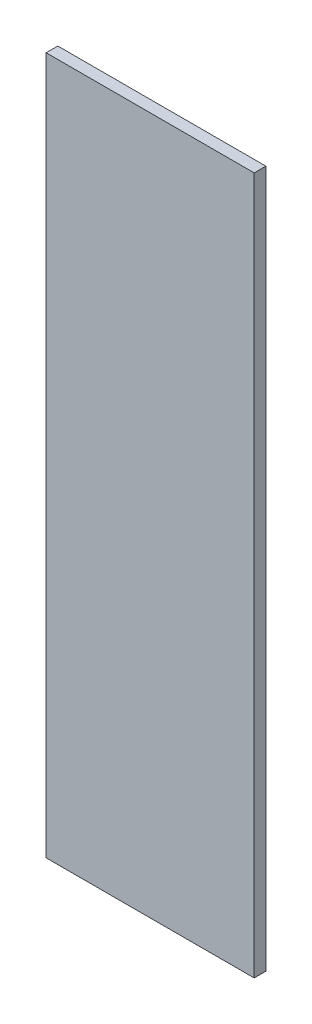
from build123d import *

# Parameters (mm, degrees)
SKETCH1_W           = 56.59882
SKETCH1_H           = 189.655999876
BOSS_EXTRUDE1_DEPTH = 3.175


with BuildPart() as part:
    # Sketch1 → Boss-Extrude1 (new body)
    with BuildSketch(Plane.XY):
        with Locations((111.684462387, 109.368458108)):
            Rectangle(SKETCH1_W, SKETCH1_H)
    extrude(amount=BOSS_EXTRUDE1_DEPTH)


solid = part.part
